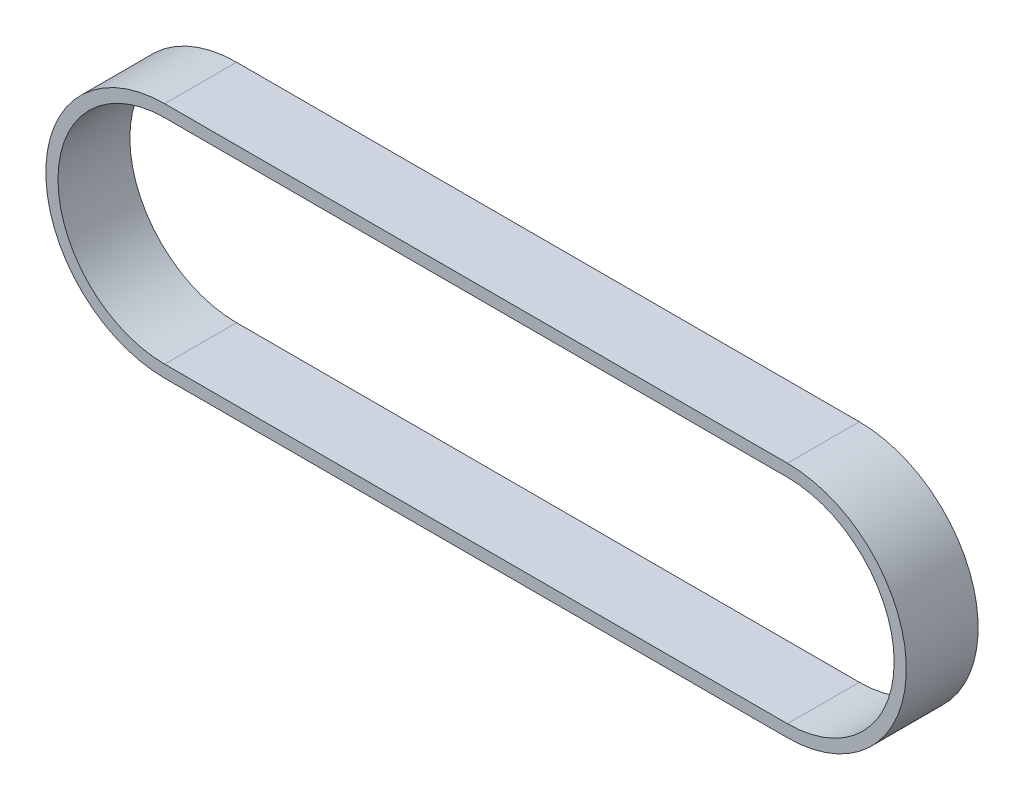
from build123d import *

# Parameters (mm, degrees)
BOSS_EXTRUDE1_DEPTH = 15


with BuildPart() as part:
    # Sketch1 → Boss-Extrude1 (new body)
    with BuildSketch(Plane.XY):
        with BuildLine():
            Line((0, 24.8158), (129.9972, 24.8158))
            ThreePointArc((129.9972, 24.8158), (154.813, 0), (129.9972, -24.8158))
            Line((129.9972, -24.8158), (0, -24.8158))
            ThreePointArc((0, -24.8158), (-24.8158, 0), (0, 24.8158))
        make_face()
        with BuildLine():
            Line((0, 22.2758), (129.9972, 22.2758))
            ThreePointArc((129.9972, 22.2758), (152.273, 0), (129.9972, -22.2758))
            Line((129.9972, -22.2758), (0, -22.2758))
            ThreePointArc((0, -22.2758), (-22.2758, 0), (0, 22.2758))
        make_face(mode=Mode.SUBTRACT)
    extrude(amount=BOSS_EXTRUDE1_DEPTH)


solid = part.part
